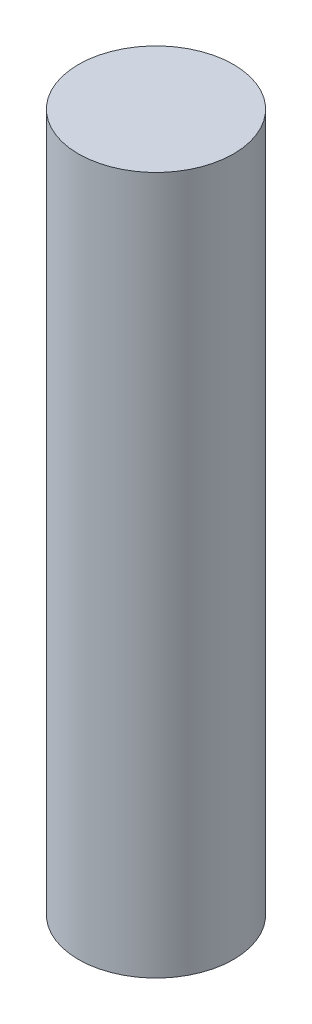
from build123d import *

# Parameters (mm, degrees)
SKETCH_1_R      = 2
EXTRUDE_1_DEPTH = 18


with BuildPart() as part:
    # 草图1 → 凸台-拉伸1 (new body)
    with BuildSketch(Plane(origin=(0, 0, 0), x_dir=(1, 0, 0), z_dir=(0, 1, 0))):
        with Locations(Location((0, 0, 0), (0, 0, 270))):
            Circle(SKETCH_1_R)
    extrude(amount=EXTRUDE_1_DEPTH)


solid = part.part
